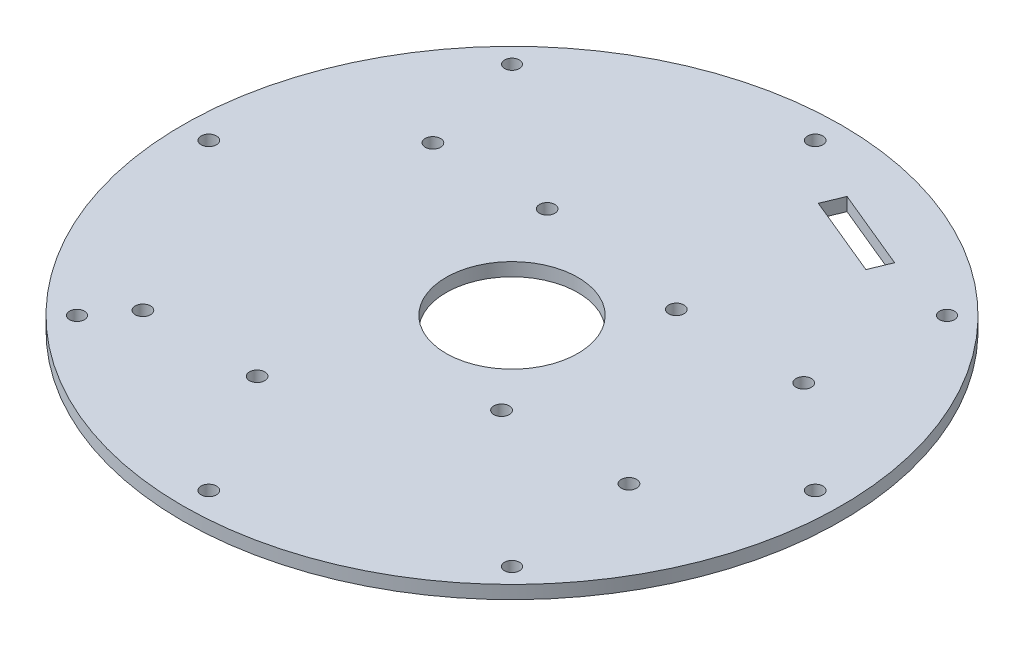
from build123d import *

# Parameters (mm, degrees)
SKETCH1_R           = 75
SKETCH1_R_2         = 1.7
SKETCH1_R_3         = 15
BOSS_EXTRUDE1_DEPTH = 3
SKETCH2_R           = 1.75
CUT_EXTRUDE2_DEPTH  = 107.108435103
SKETCH3_R           = 1.75
CUT_EXTRUDE3_DEPTH  = 107.108435103


with BuildPart() as part:
    # Sketch1 → Boss-Extrude1 (new body)
    with BuildSketch(Plane(origin=(0, 0, 0), x_dir=(1, 0, 0), z_dir=(0, 1, 0))):
        with Locations(Location((0, 0, 0), (0, 0, 270))):
            Circle(SKETCH1_R)
        with Locations(Location((49.497474683, 49.497474683, 0), (0, 0, 270))):
            Circle(SKETCH1_R_2, mode=Mode.SUBTRACT)
        with Locations(Location((-49.497474683, 49.497474683, 0), (0, 0, 270))):
            Circle(SKETCH1_R_2, mode=Mode.SUBTRACT)
        with Locations(Location((-49.497474683, -49.497474683, 0), (0, 0, 270))):
            Circle(SKETCH1_R_2, mode=Mode.SUBTRACT)
        with Locations(Location((49.497474683, -49.497474683, 0), (0, 0, 270))):
            Circle(SKETCH1_R_2, mode=Mode.SUBTRACT)
        with Locations(Location((0, 0, 0), (0, 0, 270))):
            Circle(SKETCH1_R_3, mode=Mode.SUBTRACT)
    extrude(amount=BOSS_EXTRUDE1_DEPTH)

    # Sketch2 → Cut-Extrude2 (cut, through all)
    with BuildSketch(Plane(origin=(0, 0, 0), x_dir=(1, 0, 0), z_dir=(0, 1, 0))):
        with Locations(Location((0, 69, 0), (0, 0, 270))):
            Circle(SKETCH2_R)
        with Locations(Location((69, 0, 0), (0, 0, 270))):
            Circle(SKETCH2_R)
        with Locations(Location((0, -69, 0), (0, 0, 270))):
            Circle(SKETCH2_R)
        with Locations(Location((-69, 0, 0), (0, 0, 270))):
            Circle(SKETCH2_R)
    extrude(amount=CUT_EXTRUDE2_DEPTH, mode=Mode.SUBTRACT)

    # Sketch3 → Cut-Extrude3 (cut, through all)
    with BuildSketch(Plane(origin=(0, 0, 0), x_dir=(1, 0, 0), z_dir=(0, 1, 0))):
        with Locations(Location((-43, 25, 0), (0, 0, 270))):
            Circle(SKETCH3_R)
        with Locations(Location((-17, 25, 0), (0, 0, 270))):
            Circle(SKETCH3_R)
        with Locations(Location((-17, -41, 0), (0, 0, 270))):
            Circle(SKETCH3_R)
        with Locations(Location((-43, -41, 0), (0, 0, 270))):
            Circle(SKETCH3_R)
        with Locations(Location((17.505557347, 19.884131141, 0), (0, 0, 270))):
            Circle(SKETCH3_R)
        with Locations(Location((46.494442653, -19.884131141, 0), (0, 0, 270))):
            Circle(SKETCH3_R)
        with Locations(Location((46.494442653, 19.884131141, 0), (0, 0, 270))):
            Circle(SKETCH3_R)
        with Locations(Location((17.505557347, -19.884131141, 0), (0, 0, 270))):
            Circle(SKETCH3_R)
        Polygon((31.243092686, 49.296238796), (12.765502036, 56.949907443), (14.678919198, 61.569305106), (33.156509848, 53.915636458), align=None)
    extrude(amount=CUT_EXTRUDE3_DEPTH, mode=Mode.SUBTRACT)


solid = part.part
